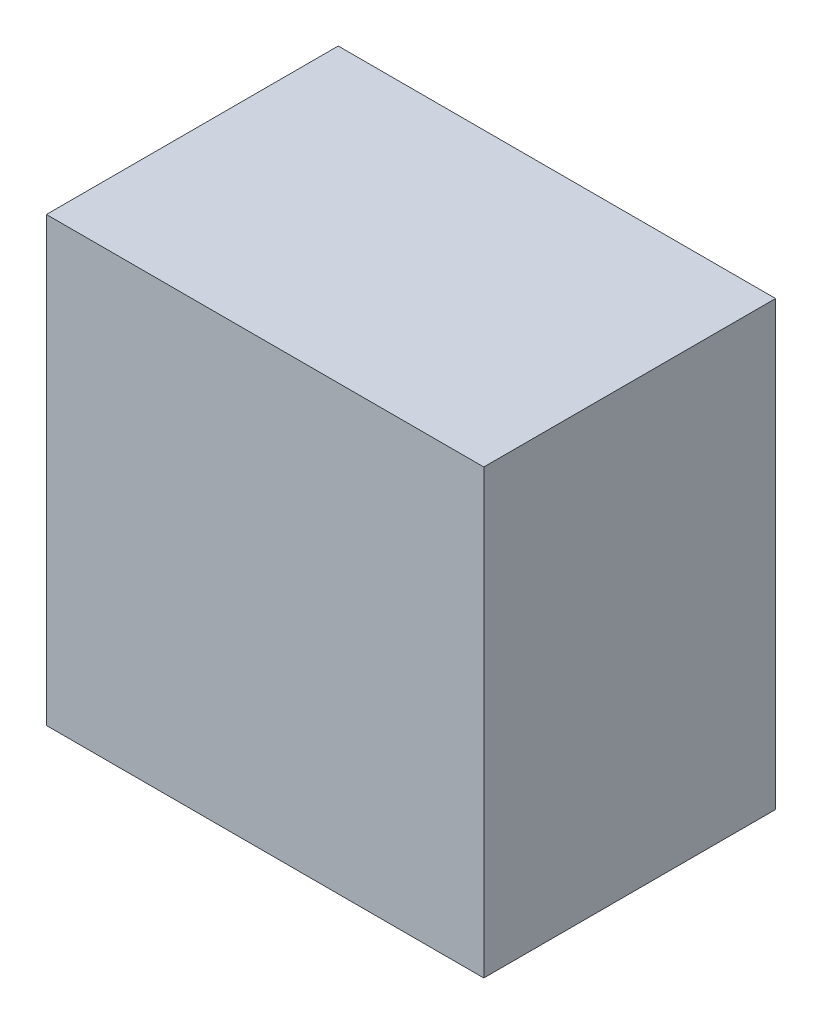
from build123d import *

# Parameters (mm, degrees)
SKETCH1_W           = 74.941172826
SKETCH1_H           = 75.831077289
BOSS_EXTRUDE1_DEPTH = 50


with BuildPart() as part:
    # Sketch1 → Boss-Extrude1 (new body)
    with BuildSketch(Plane.XY):
        with Locations((-8.122477821, -14.335596956)):
            Rectangle(SKETCH1_W, SKETCH1_H)
    extrude(amount=BOSS_EXTRUDE1_DEPTH)


solid = part.part
